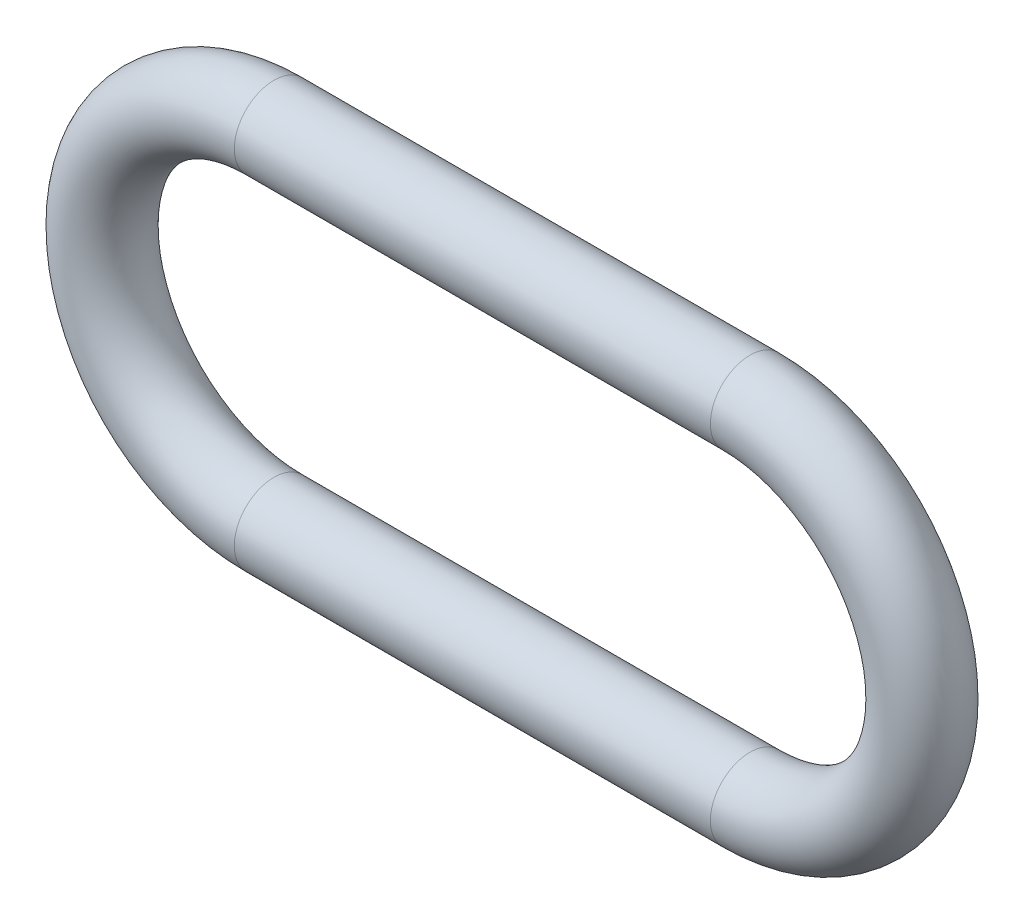
from build123d import *

# Parameters (mm, degrees)
ESQUISSE2_R = 1.5


with BuildPart() as part:
    # Balayage1: sweep along a path in Esquisse1
    with BuildLine(Plane.XY) as balayage1_path:
        Line((0, 6.5), (18, 6.5))
        ThreePointArc((18, 6.5), (24.5, 0), (18, -6.5))
        Line((18, -6.5), (0, -6.5))
        ThreePointArc((0, -6.5), (-6.5, 0), (0, 6.5))
    # Esquisse2 → Balayage1 (sweep)
    with BuildSketch(Plane(origin=(0, 0, 0), x_dir=(0, 0, -1), z_dir=(1, 0, 0))):
        with Locations((0, 6.5)):
            Circle(ESQUISSE2_R)
    sweep(path=balayage1_path.line)


solid = part.part
